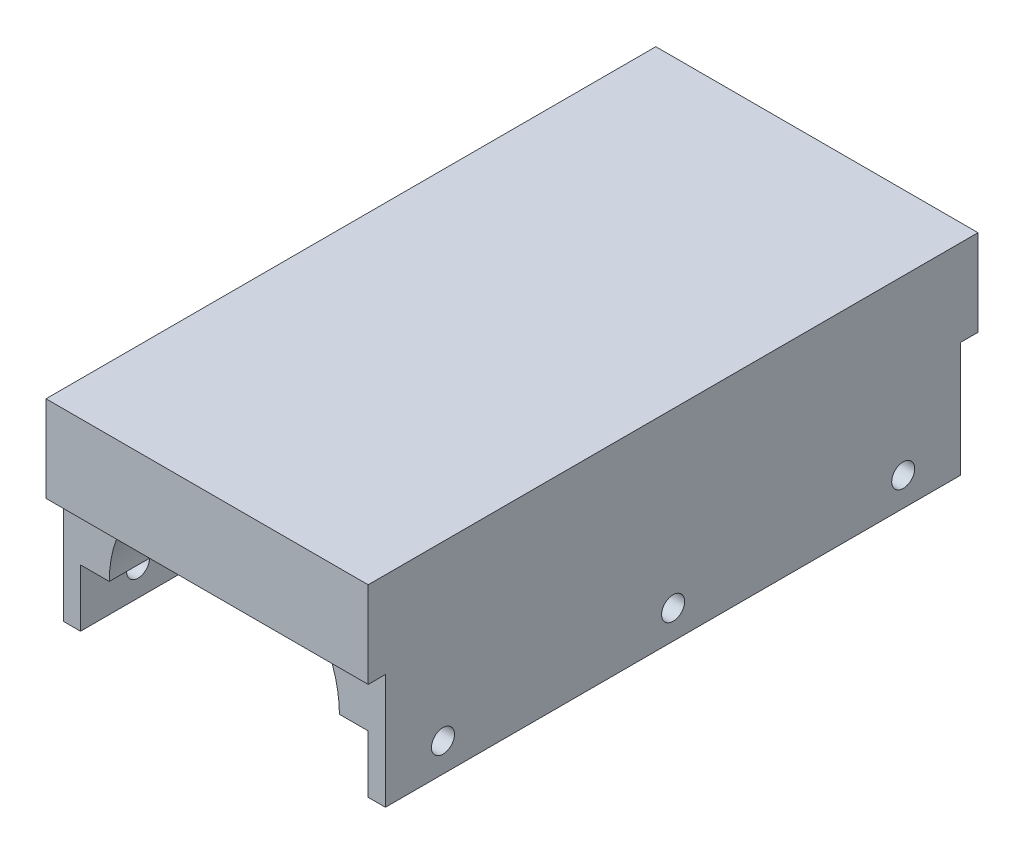
from build123d import *

# Parameters (mm, degrees)
BOSS_EXTRUDE1_DEPTH     = 50
CUT_EXTRUDE1_DEPTH      = 100
CUT_EXTRUDE1_DEPTH_BACK = 100
SKETCH2_R               = 2
SKETCH3_W               = 56
SKETCH3_H               = 15
BOSS_EXTRUDE2_DEPTH     = 3


with BuildPart() as part:
    # Sketch1 → Boss-Extrude1 (new, symmetric)
    with BuildSketch(Plane.XY):
        with BuildLine():
            Line((-28, 25), (-28, -10))
            Line((-28, -10), (-25, -10))
            Line((-25, -10), (-25, 0))
            Line((-25, 0), (-20, 0))
            ThreePointArc((-20, 0), (0, 20), (20, 0))
            Line((20, 0), (25, 0))
            Line((25, 0), (25, -10))
            Line((25, -10), (28, -10))
            Line((28, -10), (28, 25))
            Line((28, 25), (-28, 25))
        make_face()
    extrude(amount=BOSS_EXTRUDE1_DEPTH, both=True)

    # Sketch2 → Cut-Extrude1 (cut, two sides: drawn at the far end of the back side and taken through both)
    with BuildSketch(Plane(origin=(-25, 0, 0), x_dir=(0, 0, -1), z_dir=(1, 0, 0)).offset(-CUT_EXTRUDE1_DEPTH_BACK)):
        with Locations((-40, -5)):
            Circle(SKETCH2_R)
        with Locations((0, -5)):
            Circle(SKETCH2_R)
        with Locations((40, -5)):
            Circle(SKETCH2_R)
    extrude(amount=CUT_EXTRUDE1_DEPTH + CUT_EXTRUDE1_DEPTH_BACK, mode=Mode.SUBTRACT)

    # Sketch3 → Boss-Extrude2 (add)
    with BuildSketch(Plane.XY.offset(50)):
        with Locations((0, 17.5)):
            Rectangle(SKETCH3_W, SKETCH3_H)
    boss_extrude2 = extrude(amount=BOSS_EXTRUDE2_DEPTH)

    # Mirror1: Boss-Extrude2 across plane
    add(boss_extrude2.mirror(Plane.XY))


solid = part.part
